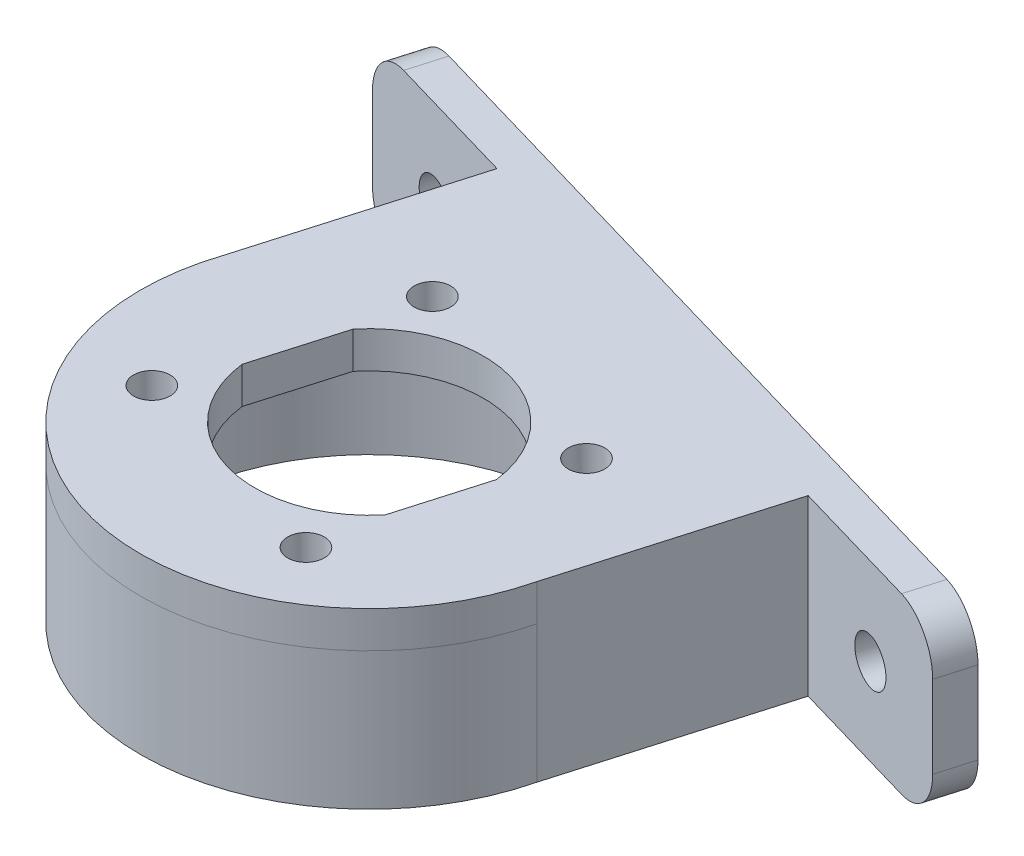
from build123d import *

# Parameters (mm, degrees)
SKETCH1_R           = 25.000000000000004
SKETCH1_R_2         = 1.9999999999993712
SKETCH1_R_3         = 2.0000000000000036
SKETCH1_R_4         = 2.0000000000002736
SKETCH1_R_5         = 1.9999999999996778
BOSS_EXTRUDE1_DEPTH = 4
SKETCH2_R           = 25
SKETCH2_R_2         = 22.50000000000001
BOSS_EXTRUDE2_DEPTH = 15
BOSS_EXTRUDE7_REACH = 78.843
SKETCH4_W           = 49.955357531530346
SKETCH4_H           = 19
BOSS_EXTRUDE8_DEPTH = 4
SKETCH7_R           = 2.499999999999995
SKETCH7_R_2         = 2.5000000000000004
CUT_EXTRUDE1_DEPTH  = 4
FILLET1_R           = 5
FILLET2_R           = 5


with BuildPart() as part:
    # Sketch1 → Boss-Extrude1 (new body)
    with BuildSketch(Plane(origin=(0, 0, 0), x_dir=(1, 0, 0), z_dir=(0, 1, 0))):
        with Locations(Location((21.22072875619714, -40.09390888269783, 0), (0, 0, 270))):
            Circle(SKETCH1_R)
        with Locations(Location((29.646509797315062, -55.43197309716617, 0), (0, 0, 270))):
            Circle(SKETCH1_R_2, mode=Mode.SUBTRACT)
        with Locations(Location((36.558792970665294, -31.668127841580553, 0), (0, 0, 270))):
            Circle(SKETCH1_R_3, mode=Mode.SUBTRACT)
        with Locations(Location((12.794947715079665, -24.75584466823032, 0), (0, 0, 270))):
            Circle(SKETCH1_R_4, mode=Mode.SUBTRACT)
        with Locations(Location((5.8826645417294365, -48.51968992381595, 0), (0, 0, 270))):
            Circle(SKETCH1_R_5, mode=Mode.SUBTRACT)
        with BuildLine():
            ThreePointArc((8.810101512256844, -41.5859984952772), (17.729498538084204, -52.096463259335145), (30.894801565269475, -48.009862096604984))
            Line((30.894801565269475, -48.009862096604984), (33.63135600013741, -38.60181927011846))
            ThreePointArc((33.63135600013741, -38.60181927011846), (24.711958974310075, -28.091354506060547), (11.5466559471248, -32.177955668790645))
            Line((11.5466559471248, -32.177955668790645), (8.810101512256844, -41.5859984952772))
        make_face(mode=Mode.SUBTRACT)
    extrude(amount=BOSS_EXTRUDE1_DEPTH)

    # Sketch2 → Boss-Extrude2 (add)
    with BuildSketch(Plane.XZ):
        with Locations(Location((21.22070938805554, 40.093908619998004, 0), (0, 0, 270.77710591))):
            Circle(SKETCH2_R)
        with Locations(Location((21.22070938805554, 40.093908619998004, 0), (0, 0, 270))):
            Circle(SKETCH2_R_2, mode=Mode.SUBTRACT)
    extrude(amount=BOSS_EXTRUDE2_DEPTH)

    # Sketch4 → Boss-Extrude7 (add, up to next)
    with BuildSketch(Plane(origin=(-2.11468835096776, 0, 7.270119796296657), x_dir=(-0.9602043501309836, 0, -0.2792984174490354), z_dir=(0.2792984174490354, 0, -0.9602043501309836)), mode=Mode.PRIVATE) as boss_extrude7_sk1:
        with Locations((-31.573501878114026, -5.500000000000001)):
            Rectangle(SKETCH4_W, SKETCH4_H)
    boss_extrude7_tool1 = extrude(boss_extrude7_sk1.sketch, amount=-BOSS_EXTRUDE7_REACH, mode=Mode.PRIVATE) - part.part
    add(boss_extrude7_tool1.solids().sort_by_distance((28.202326, -5.5, 16.088549))[0])

    # Sketch5 → Boss-Extrude8 (add)
    with BuildSketch(Plane(origin=(-2.114688350967763, 0, 7.270119796296668), x_dir=(-0.9602043501309836, 0, -0.27929841744903544), z_dir=(0.27929841744903544, 0, -0.9602043501309836))):
        Polygon((13.404176887651147, 4), (-76.55118064387919, 4), (-76.55118064387919, -15), (13.404176887651147, -15), (13.404176887651147, -5.5), align=None)
    extrude(amount=BOSS_EXTRUDE8_DEPTH)

    # Sketch7 → Cut-Extrude1 (cut)
    with BuildSketch(Plane(origin=(-0.9974946811716227, -2e-16, 3.4293023957727353), x_dir=(-0.9602043501309836, 0, -0.27929841744903544), z_dir=(0.27929841744903544, 0, -0.9602043501309836))):
        with Locations((-66.55118064387919, -5.499999999999998)):
            Circle(SKETCH7_R)
        with Locations((3.4041768876511456, -5.499999999999997)):
            Circle(SKETCH7_R_2)
    extrude(amount=-CUT_EXTRUDE1_DEPTH, mode=Mode.SUBTRACT)

    # Fillet1
    fillet1_edges = [part.edges().sort_by_distance(p)[0] for p in [
        (71.94868514584586, -15, 26.730334703725394),
    ]]
    fillet(fillet1_edges, radius=FILLET1_R)

    # Fillet2
    fillet2_edges = [part.edges().sort_by_distance(p)[0] for p in [
        (-14.426840473517512, -15, 1.605945704106798),
        (-14.426840473517512, 4, 1.605945704106798),
        (71.94868514584586, 4, 26.730334703725394),
    ]]
    fillet(fillet2_edges, radius=FILLET2_R)


solid = part.part
